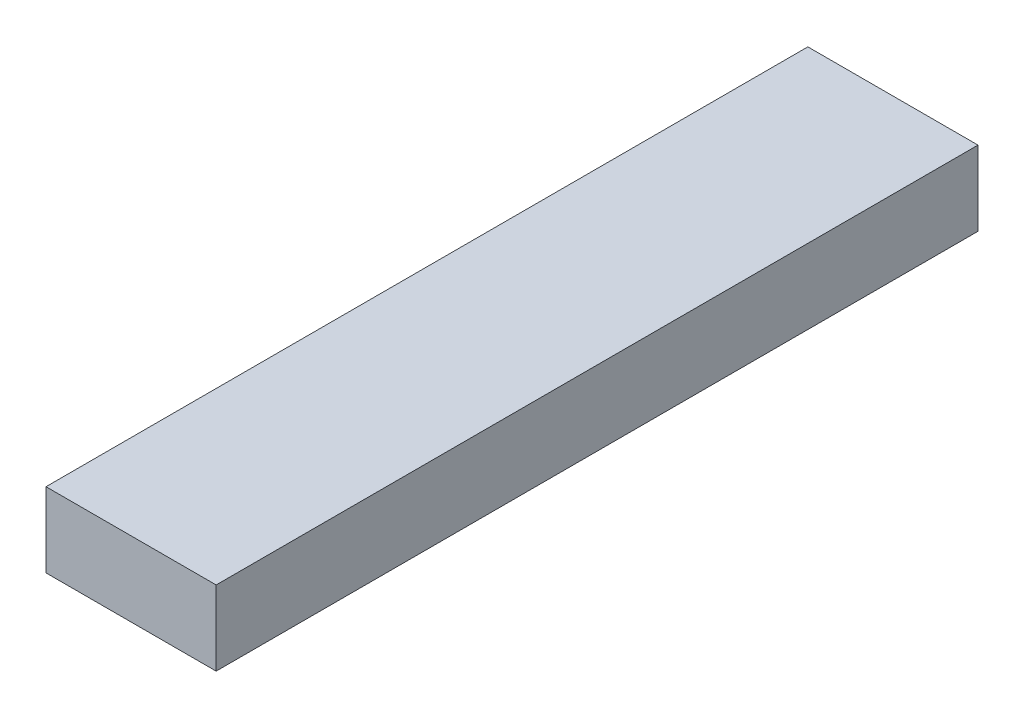
from build123d import *

# Parameters (mm, degrees)
SKETCH1_W           = 34.036
SKETCH1_H           = 14.9352
BOSS_EXTRUDE1_DEPTH = 76.2


with BuildPart() as part:
    # Sketch1 → Boss-Extrude1 (new, symmetric)
    with BuildSketch(Plane.XY):
        Rectangle(SKETCH1_W, SKETCH1_H)
    extrude(amount=BOSS_EXTRUDE1_DEPTH, both=True)


solid = part.part
